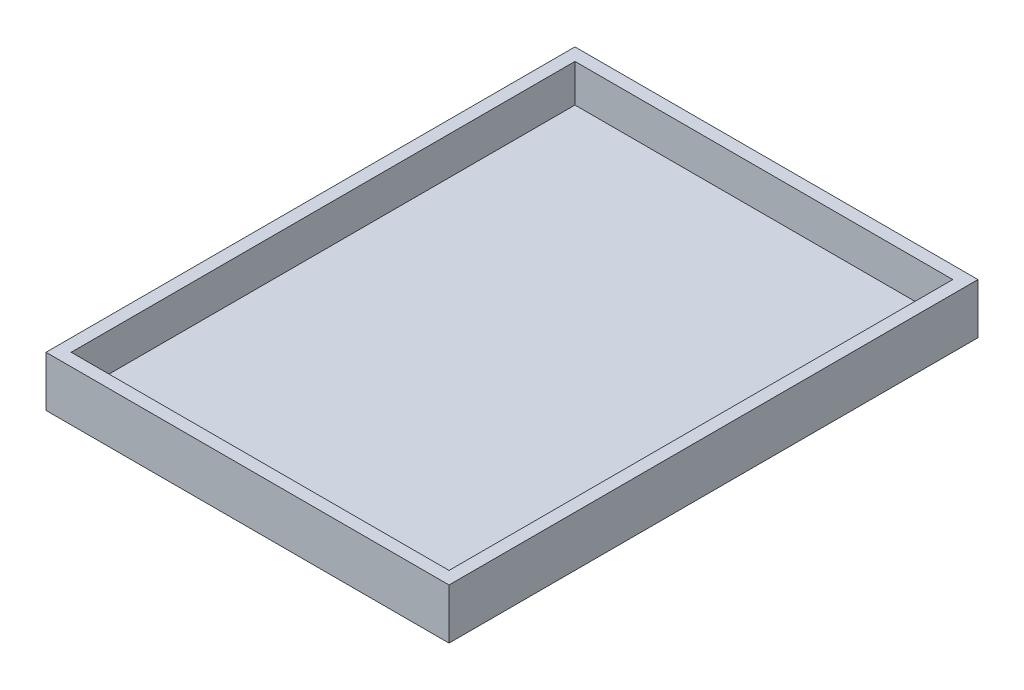
from build123d import *

# Parameters (mm, degrees)
SKETCH1_W           = 160
SKETCH1_H           = 210
BOSS_EXTRUDE1_DEPTH = 20
SHELL1_T            = -5


with BuildPart() as part:
    # Sketch1 → Boss-Extrude1 (new body)
    with BuildSketch(Plane(origin=(0, 0, 0), x_dir=(1, 0, 0), z_dir=(0, 1, 0))):
        Rectangle(SKETCH1_W, SKETCH1_H)
    extrude(amount=BOSS_EXTRUDE1_DEPTH)

    # Shell1
    shell1_openings = [part.faces().sort_by_distance(p)[0] for p in [
        (0, 20, 0),
    ]]
    offset(amount=SHELL1_T, openings=shell1_openings, kind=Kind.INTERSECTION)


solid = part.part
